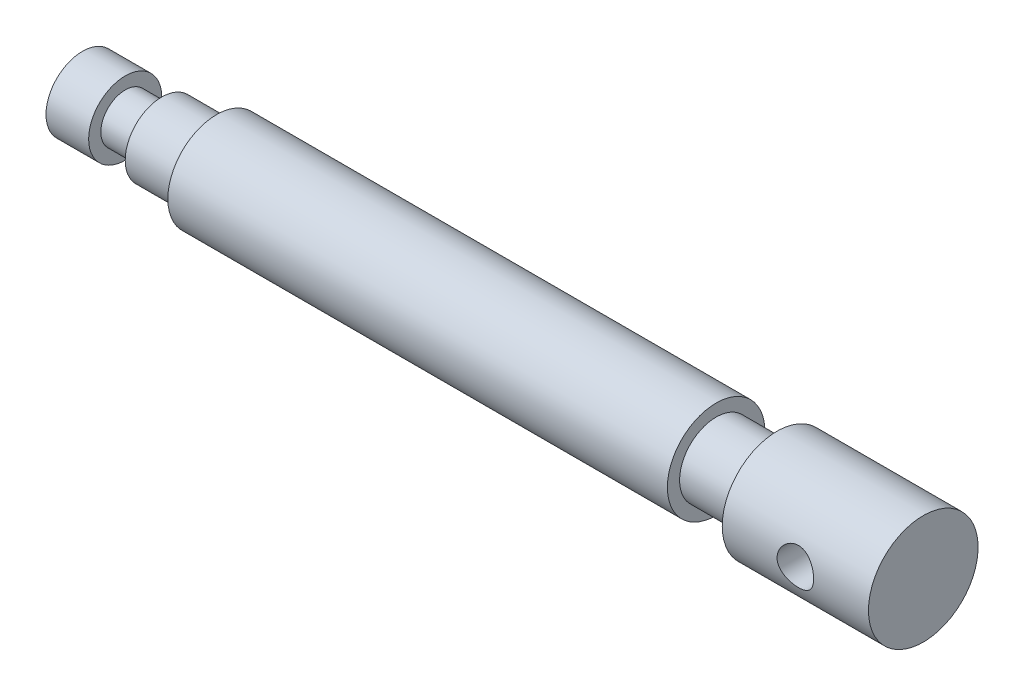
from build123d import *

# Parameters (mm, degrees)
SKETCH2_R          = 3
CUT_EXTRUDE1_DEPTH = 30


with BuildPart() as part:
    # Sketch1 → Revolve1 (revolve)
    with BuildSketch(Plane.XY, mode=Mode.PRIVATE) as revolve1_sk:
        Polygon((0, 0), (0, 6), (7, 6), (7, 4), (13, 4), (13, 6), (22, 6), (22, 8), (104, 8), (104, 6), (114, 6), (114, 9), (138, 9), (138, 0), align=None)
    revolve(revolve1_sk.sketch.rotate(Axis((0, 0, 0), (1, 0, 0)), 90), axis=Axis((0, 0, 0), (1, 0, 0)))

    # Sketch2 → Cut-Extrude1 (cut, symmetric)
    with BuildSketch(Plane.XY):
        with Locations((126, 0)):
            Circle(SKETCH2_R)
    extrude(amount=CUT_EXTRUDE1_DEPTH, both=True, mode=Mode.SUBTRACT)


solid = part.part
